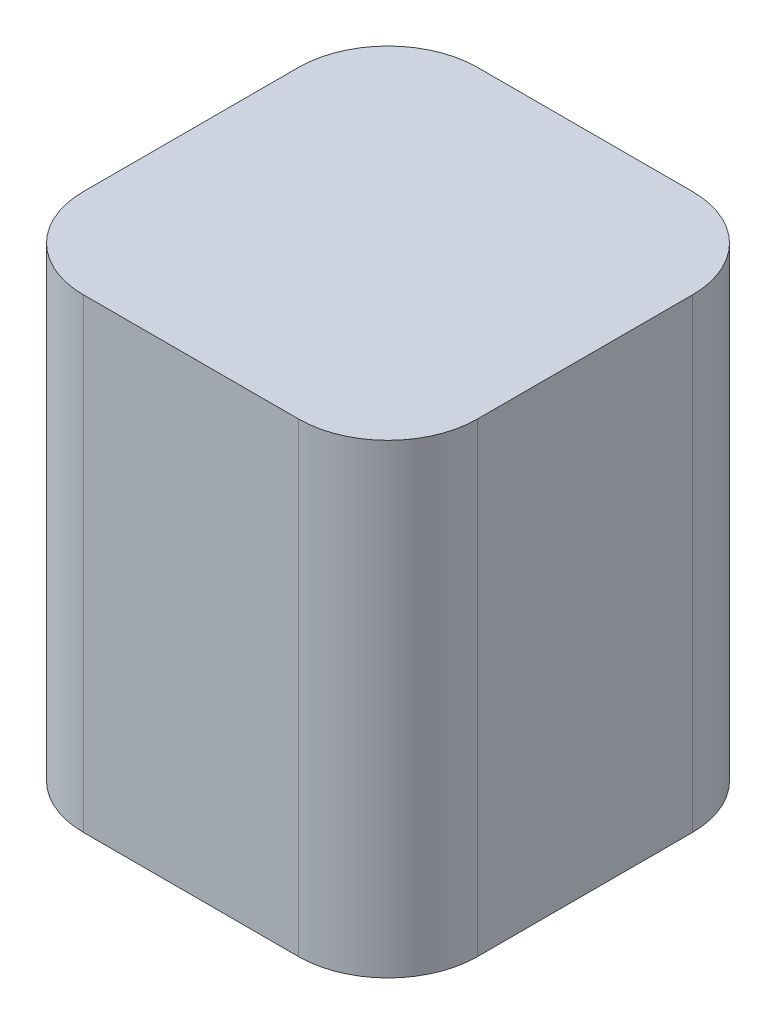
from build123d import *

# Parameters (mm, degrees)
SKETCH1_W           = 55.88
SKETCH1_H           = 55.88
BOSS_EXTRUDE1_DEPTH = 66.04
FILLET1_R           = 12.7


with BuildPart() as part:
    # Sketch1 → Boss-Extrude1 (new body)
    with BuildSketch(Plane(origin=(0, 0, 0), x_dir=(1, 0, 0), z_dir=(0, 1, 0))):
        Rectangle(SKETCH1_W, SKETCH1_H)
    extrude(amount=BOSS_EXTRUDE1_DEPTH)

    # Fillet1
    fillet1_edges = [part.edges().sort_by_distance(p)[0] for p in [
        (27.94, 33.02, 27.94),
        (-27.94, 33.02, 27.94),
        (-27.94, 33.02, -27.94),
        (27.94, 33.02, -27.94),
    ]]
    fillet(fillet1_edges, radius=FILLET1_R)


solid = part.part
